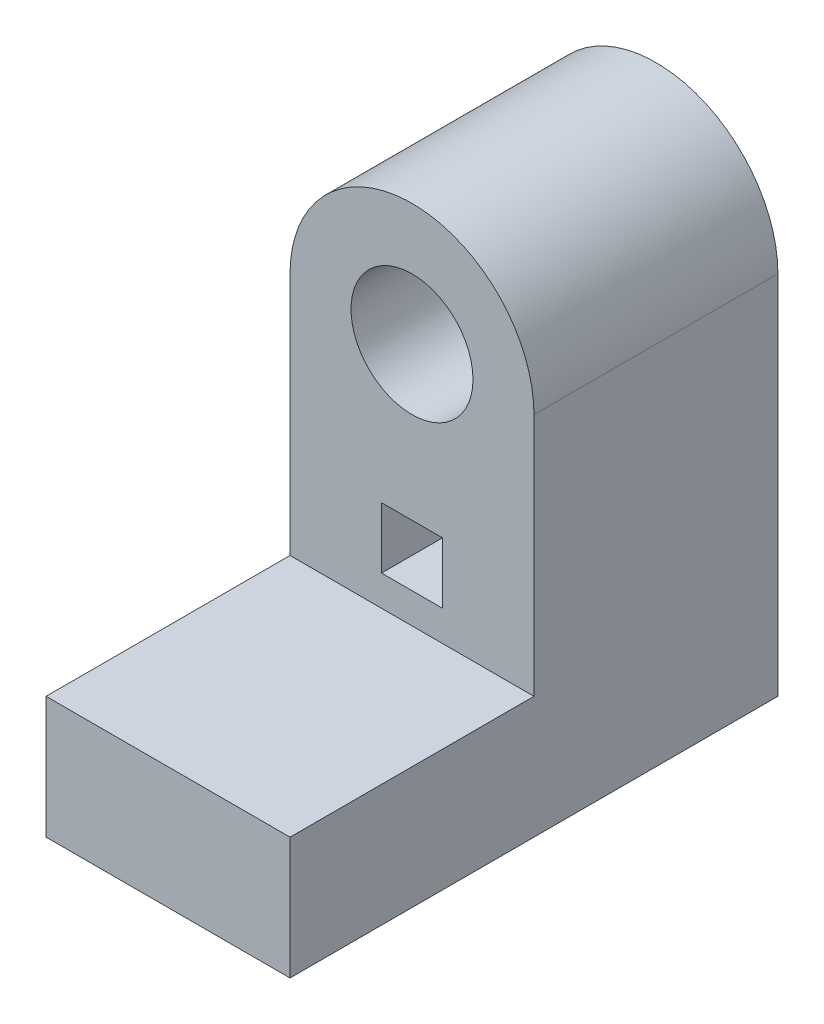
from build123d import *

# Parameters (mm, degrees)
SKETCH2_R           = 12.7
SKETCH2_W           = 12.7
SKETCH2_H           = 12.7
BOSS_EXTRUDE1_DEPTH = 50.8
SKETCH3_W           = 50.8
SKETCH3_H           = 25.4
BOSS_EXTRUDE2_DEPTH = 101.6


with BuildPart() as part:
    # Sketch2 → Boss-Extrude1 (new body)
    with BuildSketch(Plane.XY):
        with BuildLine():
            Line((50.8, 25.4), (50.8, 76.2))
            ThreePointArc((50.8, 76.2), (25.4, 101.6), (0, 76.2))
            Line((0, 76.2), (0, 25.4))
            Line((0, 25.4), (0, 0))
            Line((0, 0), (50.8, 0))
            Line((50.8, 0), (50.8, 25.4))
        make_face()
        with Locations((25.4, 76.2)):
            Circle(SKETCH2_R, mode=Mode.SUBTRACT)
        with Locations((25.4, 38.1)):
            Rectangle(SKETCH2_W, SKETCH2_H, mode=Mode.SUBTRACT)
    extrude(amount=BOSS_EXTRUDE1_DEPTH)

    # Sketch3 → Boss-Extrude2 (add)
    with BuildSketch(Plane.XY):
        with Locations((25.4, 12.7)):
            Rectangle(SKETCH3_W, SKETCH3_H)
    extrude(amount=BOSS_EXTRUDE2_DEPTH)


solid = part.part
